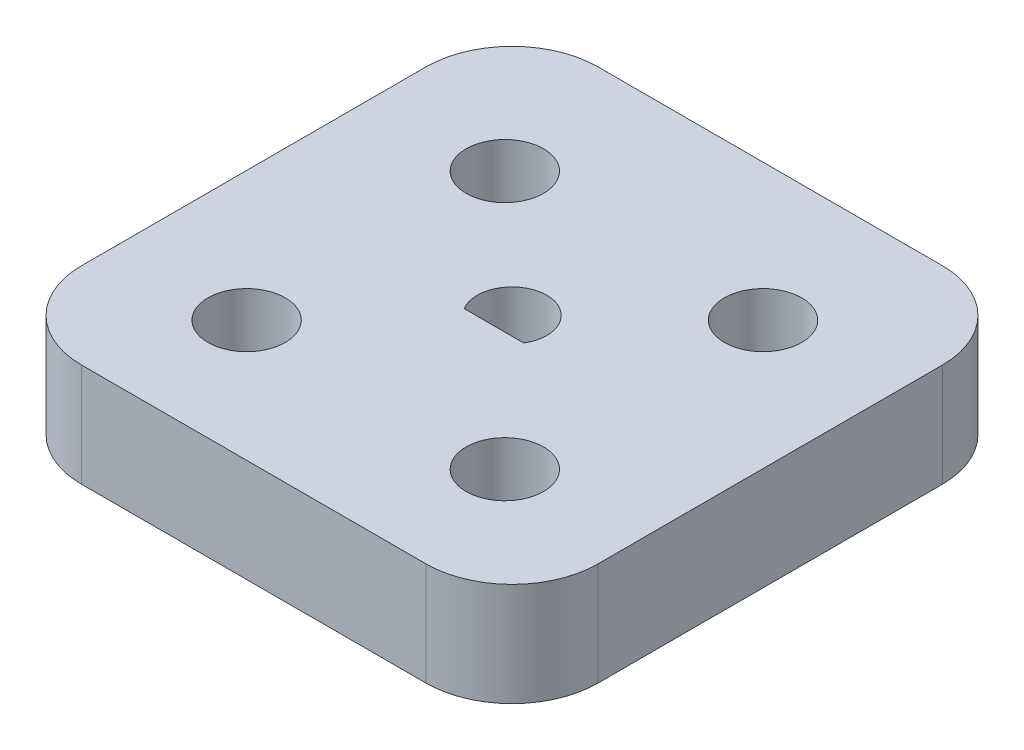
from build123d import *

# Parameters (mm, degrees)
SKETCH1_W             = 30
SKETCH1_H             = 30
BOSS_EXTRUDE1_DEPTH   = 6
FILLET1_R             = 5
F_8_CLEARANCE_HOLE1_D = 4.4958


with BuildPart() as part:
    # Sketch1 → Boss-Extrude1 (new body)
    with BuildSketch(Plane(origin=(0, 0, 0), x_dir=(1, 0, 0), z_dir=(0, 1, 0))):
        Rectangle(SKETCH1_W, SKETCH1_H)
        with BuildLine():
            Line((1.731509457, -1.05), (-1.731509457, -1.05))
            ThreePointArc((-1.731509457, -1.05), (0, 2.025), (1.731509457, -1.05))
        make_face(mode=Mode.SUBTRACT)
    extrude(amount=BOSS_EXTRUDE1_DEPTH)

    # Fillet1
    fillet1_edges = [part.edges().sort_by_distance(p)[0] for p in [
        (15, 3, 15),
        (-15, 3, 15),
        (-15, 3, -15),
        (15, 3, -15),
    ]]
    fillet(fillet1_edges, radius=FILLET1_R)

    # #8 Clearance Hole1 (through all)
    with Locations(Plane(origin=(0, 6, 0), x_dir=(1, 0, 0), z_dir=(0, 1, 0))):
        with Locations((-7.467684416, 7.05158171), (7.532315584, 7.05158171), (-7.467684416, -7.94841829), (7.532315584, -7.94841829)):
            Hole(F_8_CLEARANCE_HOLE1_D / 2)


solid = part.part
